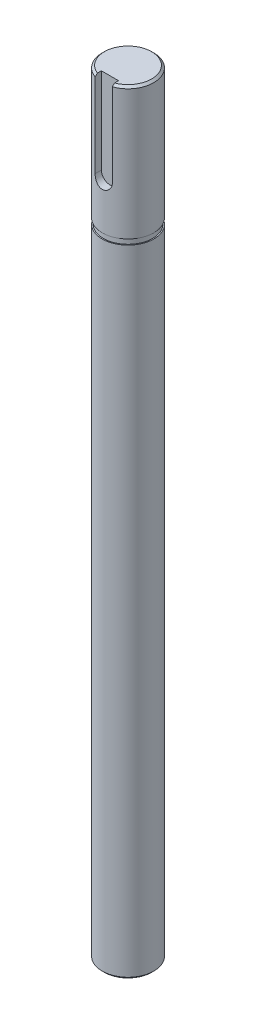
from build123d import *

# Parameters (mm, degrees)
CHAMFER1_SIZE      = 0.5
CUT_EXTRUDE1_DEPTH = 1.8


with BuildPart() as part:
    # Sketch1 → Revolve1 (revolve)
    with BuildSketch(Plane.XY, mode=Mode.PRIVATE) as revolve1_sk:
        Polygon((0, 180), (-6, 180), (-6, 149.25), (-5.75, 149.25), (-5.75, 148), (-6, 148), (-6, 0), (0, 0), align=None)
    revolve(revolve1_sk.sketch.rotate(Axis((0, 180, 0), (0, 1, 0)), 270), axis=Axis((0, 180, 0), (0, 1, 0)))

    # Chamfer1
    chamfer1_edges = [part.edges().sort_by_distance(p)[0] for p in [
        (0, 0, 6),
        (0, 180, 6),
    ]]
    chamfer(chamfer1_edges, length=CHAMFER1_SIZE)

    # Sketch2 → Cut-Extrude1 (cut)
    with BuildSketch(Plane.XY.offset(6)):
        with BuildLine():
            Line((-2, 160), (-2, 180))
            ThreePointArc((-2, 180), (0, 182), (2, 180))
            Line((2, 180), (2, 160))
            ThreePointArc((2, 160), (0, 158), (-2, 160))
        make_face()
    extrude(amount=-CUT_EXTRUDE1_DEPTH, mode=Mode.SUBTRACT)


solid = part.part
